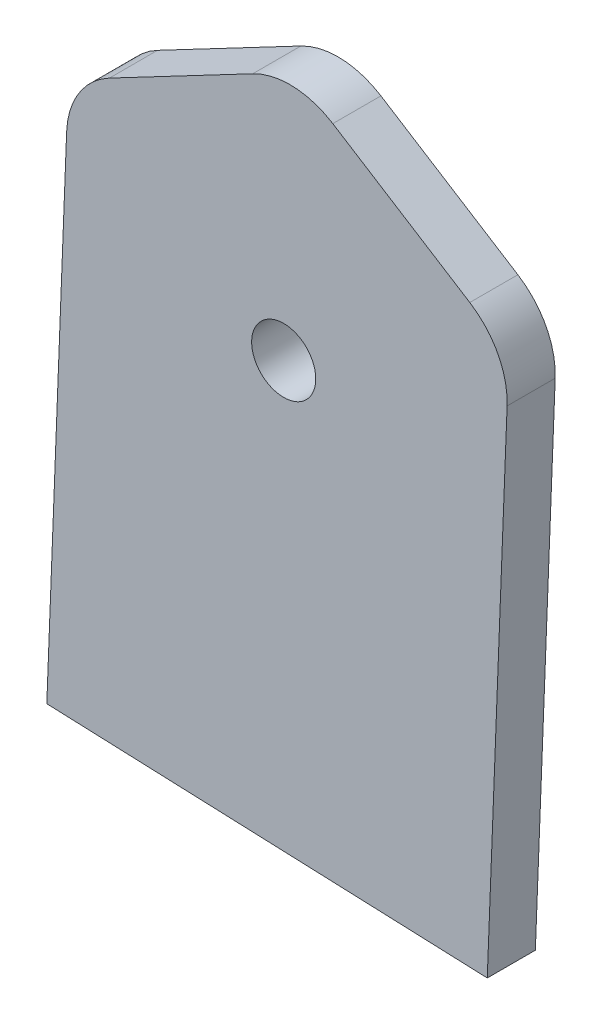
from build123d import *

# Parameters (mm, degrees)
SKETCH1_R           = 4
BOSS_EXTRUDE1_DEPTH = 6


with BuildPart() as part:
    # Sketch1 → Boss-Extrude1 (new body)
    with BuildSketch(Plane.XY):
        with BuildLine():
            Line((-200.213397345, 335.278845102), (-182.330447011, 344.688065085))
            ThreePointArc((-182.330447011, 344.688065085), (-177.281730902, 345.830599505), (-172.338147286, 344.295705283))
            Line((-172.338147286, 344.295705283), (-155.248048584, 333.513225991))
            ThreePointArc((-155.248048584, 333.513225991), (-151.734226698, 329.712176794), (-150.591692278, 324.663460686))
            Line((-150.591692278, 324.663460686), (-153.067482632, 261.612049424))
            Line((-153.067482632, 261.612049424), (-208.025131117, 263.770028338))
            Line((-208.025131117, 263.770028338), (-205.549340763, 326.8214396))
            ThreePointArc((-205.549340763, 326.8214396), (-204.014446541, 331.765023216), (-200.213397345, 335.278845102))
        make_face()
        with Locations((-178.467049866, 315.643862037)):
            Circle(SKETCH1_R, mode=Mode.SUBTRACT)
    extrude(amount=BOSS_EXTRUDE1_DEPTH)


solid = part.part
